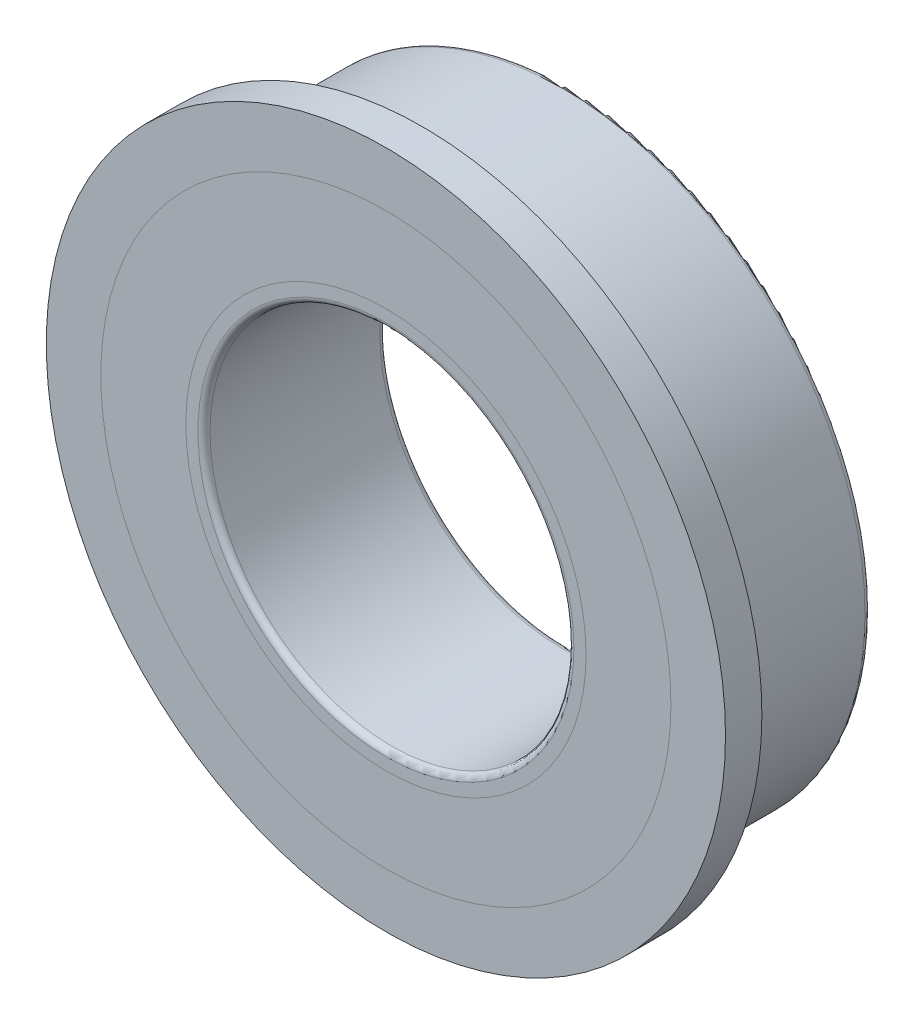
from build123d import *

# Parameters (mm, degrees)
SKETCH_1_R      = 5
SKETCH_1_R_2    = 3
EXTRUDE_1_DEPTH = 3
EXTRUDE_START   = -0.6
SKETCH_2_R      = 5.6
SKETCH_2_R_2    = 3
EXTRUDE_2_DEPTH = 0.6
FILLET_1_R      = 0.1


with BuildPart() as part:
    # ｽｹｯﾁ1 → ﾎﾞｽ - 押し出し1 (new body)
    with BuildSketch(Plane.XY):
        Circle(SKETCH_1_R)
        Circle(SKETCH_1_R_2, mode=Mode.SUBTRACT)
    extrude(amount=EXTRUDE_1_DEPTH)

    # ｽｹｯﾁ2 → ﾎﾞｽ - 押し出し2 (add)
    with BuildSketch(Plane.XY.offset(3).offset(EXTRUDE_START)):
        Circle(SKETCH_2_R)
        Circle(SKETCH_2_R_2, mode=Mode.SUBTRACT)
    extrude(amount=EXTRUDE_2_DEPTH)

    # ﾌｨﾚｯﾄ1
    fillet_1_edges = [part.edges().sort_by_distance(p)[0] for p in [
        (-5, 0, 0),
        (-3, 0, 0),
        (-3, 0, 3),
    ]]
    fillet(fillet_1_edges, radius=FILLET_1_R)


solid = part.part
